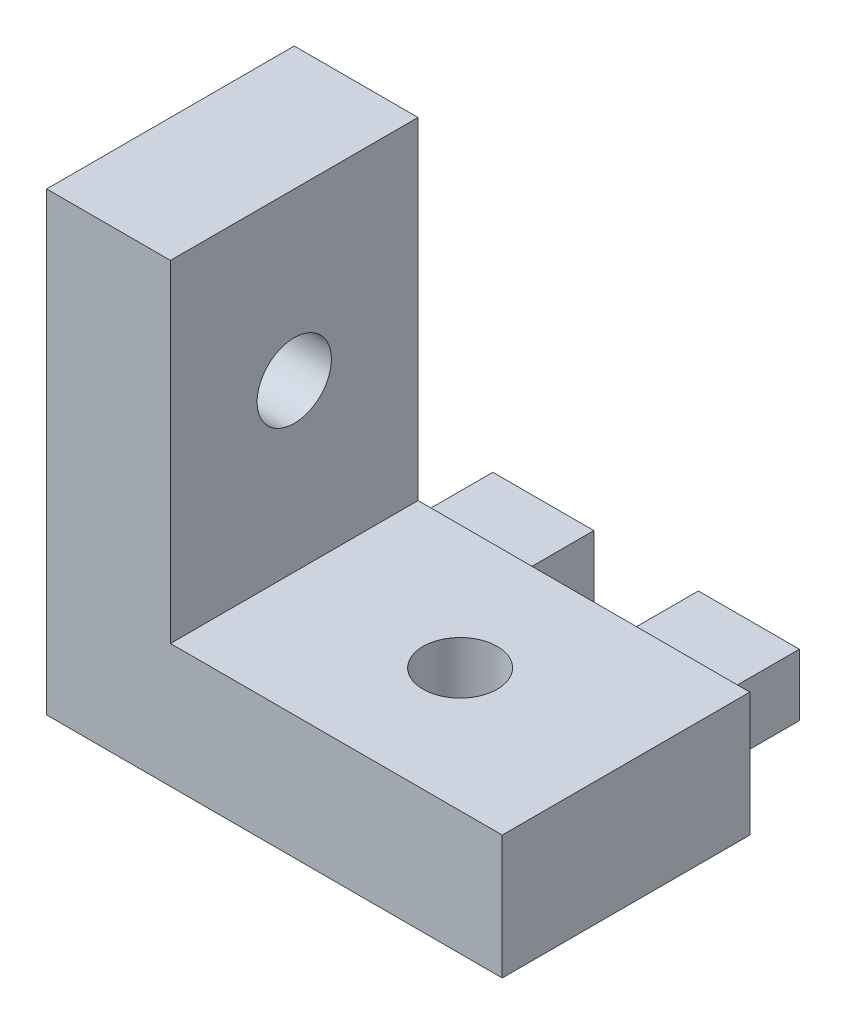
from build123d import *

# Parameters (mm, degrees)
BOSS_EXTRUDE1_DEPTH = 10
CUT_EXTRUDE1_REACH  = 22.962
SKETCH2_R           = 1.5
CUT_EXTRUDE2_REACH  = 22.893
SKETCH3_R           = 1.5
SKETCH4_W           = 4.077350098
SKETCH4_H           = 5
SKETCH4_W_2         = 4.08
BOSS_EXTRUDE2_DEPTH = 2.5


with BuildPart() as part:
    # Sketch1 → Boss-Extrude1 (new body)
    with BuildSketch(Plane.XY):
        Polygon((-0.757575758, 12.528787879), (-5.757575758, 12.528787879), (-5.757575758, -5.871212121), (12.642424242, -5.871212121), (12.642424242, -0.871212121), (-0.757575758, -0.871212121), align=None)
    extrude(amount=BOSS_EXTRUDE1_DEPTH)

    # Sketch2 → Cut-Extrude1 (cut, up to next)
    with BuildSketch(Plane(origin=(0, -0.871212121, 0), x_dir=(1, 0, 0), z_dir=(0, 1, 0)), mode=Mode.PRIVATE) as cut_extrude1_sk1:
        with Locations(Location((5.942424242, -5, 0), (0, 0, 180))):
            Circle(SKETCH2_R)
    cut_extrude1_tool1 = extrude(cut_extrude1_sk1.sketch, amount=-CUT_EXTRUDE1_REACH, mode=Mode.PRIVATE) & part.part
    add(cut_extrude1_tool1.solids().sort_by_distance((5.942424, -0.871212, 5))[0], mode=Mode.SUBTRACT)

    # Sketch3 → Cut-Extrude2 (cut, up to next)
    with BuildSketch(Plane(origin=(-0.757575758, 0, 0), x_dir=(0, 0, -1), z_dir=(1, 0, 0)), mode=Mode.PRIVATE) as cut_extrude2_sk1:
        with Locations((-5, 5.828787879)):
            Circle(SKETCH3_R)
    cut_extrude2_tool1 = extrude(cut_extrude2_sk1.sketch, amount=-CUT_EXTRUDE2_REACH, mode=Mode.PRIVATE) & part.part
    add(cut_extrude2_tool1.solids().sort_by_distance((-0.757576, 5.828788, 5))[0], mode=Mode.SUBTRACT)

    # Sketch4 → Boss-Extrude2 (add)
    with BuildSketch(Plane.XZ.offset(5.871212121)):
        with Locations((7.603749193, -2.5)):
            Rectangle(SKETCH4_W, SKETCH4_H)
        with Locations((-0.697575758, -2.5)):
            Rectangle(SKETCH4_W_2, SKETCH4_H)
    extrude(amount=-BOSS_EXTRUDE2_DEPTH)


solid = part.part
